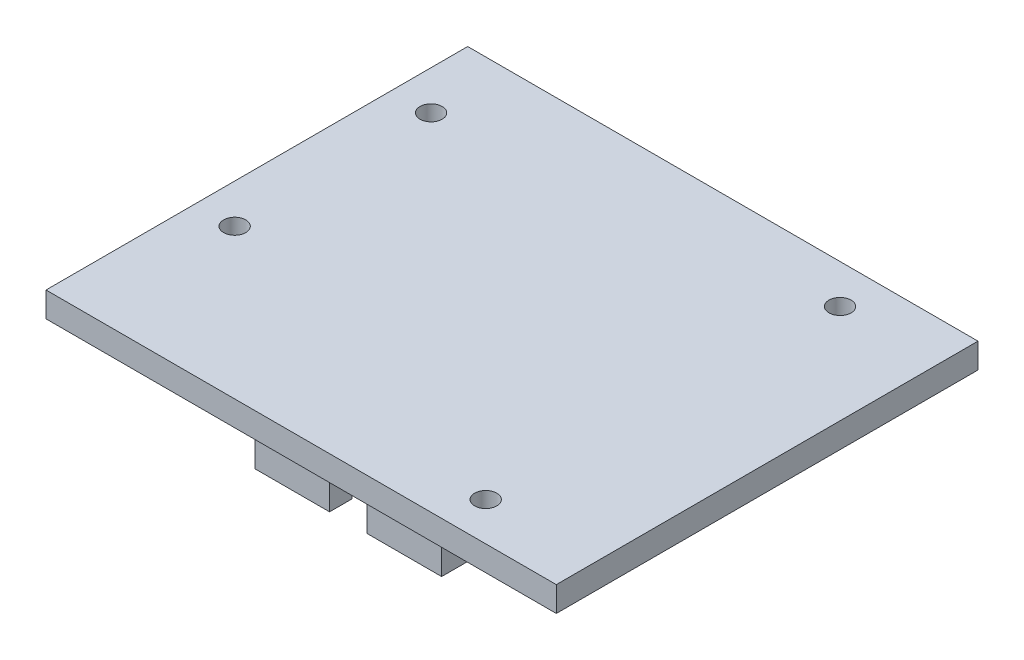
from build123d import *

# Parameters (mm, degrees)
SKETCH_1_W               = 71.4
SKETCH_1_H               = 59
EXTRUDE_1_DEPTH          = 3.5
CUT_EXTRUDE_4_DEPTH      = 8.5
CUT_EXTRUDE_4_DEPTH_BACK = 15
SKETCH_2_R               = 1.55
SKETCH_5_W               = 26.11
SKETCH_5_H               = 45.8
EXTRUDE_2_DEPTH          = 10.15
SKETCH_6_W               = 20
SKETCH_6_H               = 39.55
CUT_EXTRUDE_5_DEPTH      = 10.15
SKETCH_9_W               = 5.05
SKETCH_9_H               = 10.15
CUT_EXTRUDE_6_DEPTH      = 10
SKETCH_12_W              = 0.1
SKETCH_12_H              = 3.125
CUT_EXTRUDE_7_DEPTH      = 10


with BuildPart() as part:
    # 草圖1 → 填料-伸長1 (new body)
    with BuildSketch(Plane(origin=(0, 0, 0), x_dir=(1, 0, 0), z_dir=(0, 1, 0))):
        Rectangle(SKETCH_1_W, SKETCH_1_H)
    extrude(amount=-EXTRUDE_1_DEPTH)

    # 草圖2 → 除料-伸長4 (cut, two sides: drawn at the far end of the back side and taken through both)
    with BuildSketch(Plane(origin=(0, 0, 0), x_dir=(1, 0, 0), z_dir=(0, 1, 0)).offset(-CUT_EXTRUDE_4_DEPTH_BACK)):
        with Locations(Location((20.453418067, -24.130543915, 0), (0, 0, 270))):
            Circle(SKETCH_2_R)
        with Locations(Location((-30.223577589, 18.9, 0), (0, 0, 270))):
            Circle(SKETCH_2_R)
        with Locations(Location((-30.223577589, -8.577967438, 0), (0, 0, 270))):
            Circle(SKETCH_2_R)
        with Locations(Location((21.85, 24.05, 0), (0, 0, 270))):
            Circle(SKETCH_2_R)
    extrude(amount=CUT_EXTRUDE_4_DEPTH + CUT_EXTRUDE_4_DEPTH_BACK, mode=Mode.SUBTRACT)

    # 草圖5 → 填料-伸長2 (add)
    with BuildSketch(Plane(origin=(0, -3.5, 0), x_dir=(-1, 0, 0), z_dir=(0, -1, 0))):
        Rectangle(SKETCH_5_W, SKETCH_5_H)
    extrude(amount=EXTRUDE_2_DEPTH)

    # 草圖6 → 除料-伸長5 (cut)
    with BuildSketch(Plane.XZ.offset(13.65)):
        Rectangle(SKETCH_6_W, SKETCH_6_H)
    extrude(amount=-CUT_EXTRUDE_5_DEPTH, mode=Mode.SUBTRACT)

    # 草圖9 → 除料-伸長6 (cut)
    with BuildSketch(Plane.XY.offset(22.9)):
        with Locations((0, -8.575)):
            Rectangle(SKETCH_9_W, SKETCH_9_H)
    extrude(amount=-CUT_EXTRUDE_6_DEPTH, mode=Mode.SUBTRACT)

    # 草圖12 → 除料-伸長7 (cut)
    with BuildSketch(Plane.XZ.offset(13.65)):
        with Locations((-2.575, 21.3375)):
            Rectangle(SKETCH_12_W, SKETCH_12_H)
        with Locations((2.575, 21.3375)):
            Rectangle(SKETCH_12_W, SKETCH_12_H)
    extrude(amount=-CUT_EXTRUDE_7_DEPTH, mode=Mode.SUBTRACT)


solid = part.part
